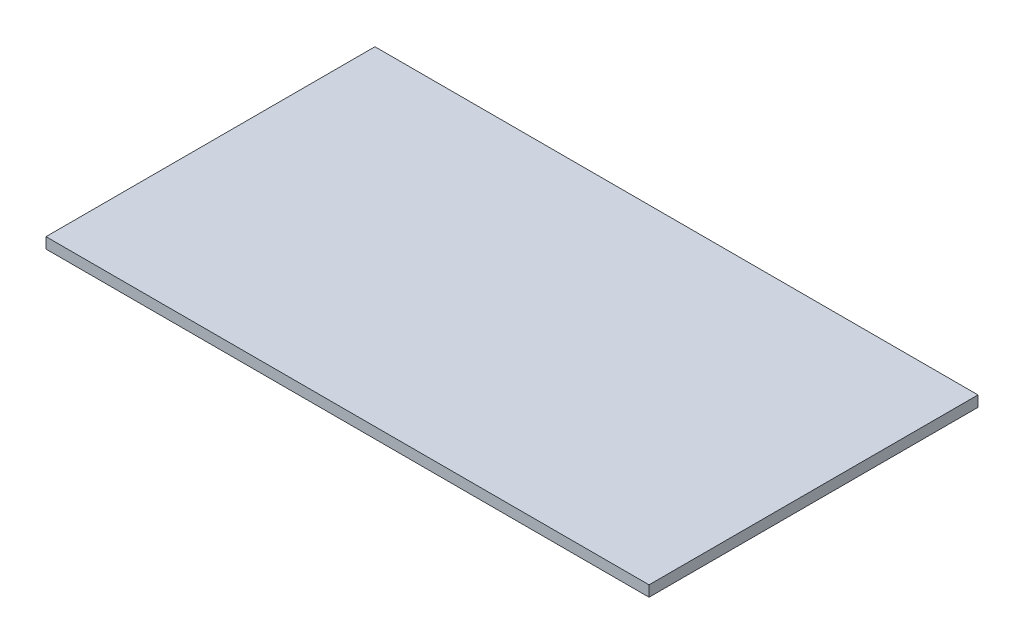
from build123d import *

# Parameters (mm, degrees)
SKETCH1_W           = 558.8
SKETCH1_H           = 304.8
BOSS_EXTRUDE1_DEPTH = 10


with BuildPart() as part:
    # Sketch1 → Boss-Extrude1 (new body)
    with BuildSketch(Plane(origin=(0, 0, 0), x_dir=(1, 0, 0), z_dir=(0, 1, 0))):
        Rectangle(SKETCH1_W, SKETCH1_H)
    extrude(amount=BOSS_EXTRUDE1_DEPTH)


solid = part.part
